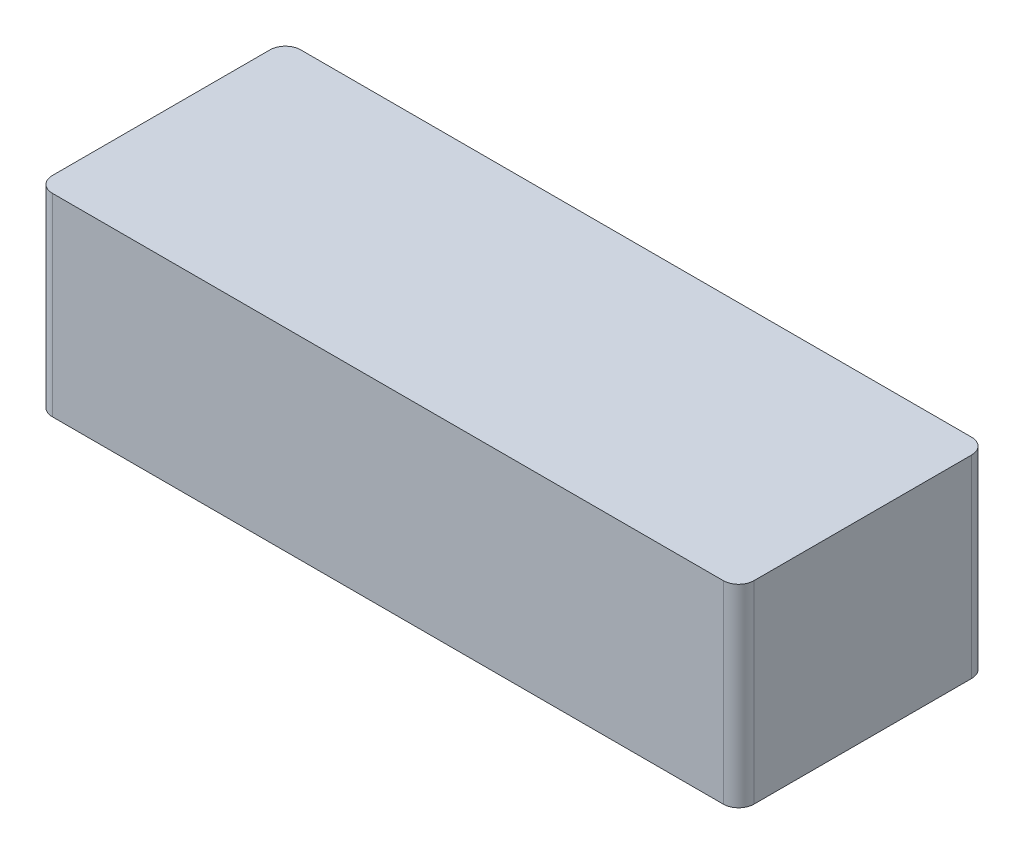
from build123d import *

# Parameters (mm, degrees)
BOSS_EXTRUDE1_DEPTH = 31.5
SHELL1_T            = -1
BOSS_EXTRUDE2_DEPTH = 30.5
BOSS_EXTRUDE4_START = -6.3
BOSS_EXTRUDE4_DEPTH = 6.3
SKETCH5_R           = 1.5
CUT_EXTRUDE2_DEPTH  = 5


with BuildPart() as part:
    # Sketch1 → Boss-Extrude1 (new body)
    with BuildSketch(Plane(origin=(0, 0, 0), x_dir=(1, 0, 0), z_dir=(0, 1, 0))):
        with BuildLine():
            Line((-68.5, -21.25), (-68.5, 21.25))
            ThreePointArc((-68.5, 21.25), (-67.621320344, 23.371320344), (-65.5, 24.25))
            Line((-65.5, 24.25), (65.5, 24.25))
            ThreePointArc((65.5, 24.25), (67.621320344, 23.371320344), (68.5, 21.25))
            Line((68.5, 21.25), (68.5, -21.25))
            ThreePointArc((68.5, -21.25), (67.621320344, -23.371320344), (65.5, -24.25))
            Line((65.5, -24.25), (-65.5, -24.25))
            ThreePointArc((-65.5, -24.25), (-67.621320344, -23.371320344), (-68.5, -21.25))
        make_face()
    extrude(amount=BOSS_EXTRUDE1_DEPTH)

    # Shell1
    shell1_openings = [part.faces().sort_by_distance(p)[0] for p in [
        (0, 0, 0),
    ]]
    offset(amount=SHELL1_T, openings=shell1_openings, kind=Kind.INTERSECTION)

    # Sketch2 → Boss-Extrude2 (add)
    with BuildSketch(Plane(origin=(0, 0, 0), x_dir=(1, 0, 0), z_dir=(0, 1, 0))):
        with BuildLine():
            Line((-68.5, 21.25), (-68.5, 17))
            Line((-68.5, 17), (-63.5, 17))
            ThreePointArc((-63.5, 17), (-61.909009742, 17.659009742), (-61.25, 19.25))
            Line((-61.25, 19.25), (-61.25, 24.25))
            Line((-61.25, 24.25), (-65.5, 24.25))
            ThreePointArc((-65.5, 24.25), (-67.621320344, 23.371320344), (-68.5, 21.25))
        make_face()
        with BuildLine():
            Line((-65.5, -24.25), (-61.25, -24.25))
            Line((-61.25, -24.25), (-61.25, -19.25))
            ThreePointArc((-61.25, -19.25), (-61.909009742, -17.659009742), (-63.5, -17))
            Line((-63.5, -17), (-68.5, -17))
            Line((-68.5, -17), (-68.5, -21.25))
            ThreePointArc((-68.5, -21.25), (-67.621320344, -23.371320344), (-65.5, -24.25))
        make_face()
        with BuildLine():
            Line((68.5, 21.25), (68.5, 17))
            Line((68.5, 17), (63.5, 17))
            ThreePointArc((63.5, 17), (61.909009742, 17.659009742), (61.25, 19.25))
            Line((61.25, 19.25), (61.25, 24.25))
            Line((61.25, 24.25), (65.5, 24.25))
            ThreePointArc((65.5, 24.25), (67.621320344, 23.371320344), (68.5, 21.25))
        make_face()
        with BuildLine():
            Line((61.25, -19.25), (61.25, -24.25))
            Line((61.25, -24.25), (65.5, -24.25))
            ThreePointArc((65.5, -24.25), (67.621320344, -23.371320344), (68.5, -21.25))
            Line((68.5, -21.25), (68.5, -17))
            Line((68.5, -17), (63.5, -17))
            ThreePointArc((63.5, -17), (61.909009742, -17.659009742), (61.25, -19.25))
        make_face()
    extrude(amount=BOSS_EXTRUDE2_DEPTH)

    # Sketch4 → Boss-Extrude4 (add)
    with BuildSketch(Plane(origin=(0, 0, 0), x_dir=(1, 0, 0), z_dir=(0, 1, 0)).offset(BOSS_EXTRUDE4_START)):
        with BuildLine():
            Line((-68.5, -21.25), (-68.5, 21.25))
            ThreePointArc((-68.5, 21.25), (-67.621320344, 23.371320344), (-65.5, 24.25))
            Line((-65.5, 24.25), (65.5, 24.25))
            ThreePointArc((65.5, 24.25), (67.621320344, 23.371320344), (68.5, 21.25))
            Line((68.5, 21.25), (68.5, -21.25))
            ThreePointArc((68.5, -21.25), (67.621320344, -23.371320344), (65.5, -24.25))
            Line((65.5, -24.25), (-65.5, -24.25))
            ThreePointArc((-65.5, -24.25), (-67.621320344, -23.371320344), (-68.5, -21.25))
        make_face()
        with BuildLine():
            Line((-65.5, -23.25), (65.5, -23.25))
            ThreePointArc((65.5, -23.25), (66.914213562, -22.664213562), (67.5, -21.25))
            Line((67.5, -21.25), (67.5, 21.25))
            ThreePointArc((67.5, 21.25), (66.914213562, 22.664213562), (65.5, 23.25))
            Line((65.5, 23.25), (-65.5, 23.25))
            ThreePointArc((-65.5, 23.25), (-66.914213562, 22.664213562), (-67.5, 21.25))
            Line((-67.5, 21.25), (-67.5, -21.25))
            ThreePointArc((-67.5, -21.25), (-66.914213562, -22.664213562), (-65.5, -23.25))
        make_face(mode=Mode.SUBTRACT)
    extrude(amount=BOSS_EXTRUDE4_DEPTH)

    # Sketch5 → Cut-Extrude2 (cut)
    with BuildSketch(Plane.XZ):
        with Locations(Location((-63.5, 19.25, 0), (0, 0, 270))):
            Circle(SKETCH5_R)
        with Locations(Location((-63.5, -19.25, 0), (0, 0, 270))):
            Circle(SKETCH5_R)
        with Locations(Location((63.5, 19.25, 0), (0, 0, 270))):
            Circle(SKETCH5_R)
        with Locations(Location((63.5, -19.25, 0), (0, 0, 270))):
            Circle(SKETCH5_R)
    extrude(amount=-CUT_EXTRUDE2_DEPTH, mode=Mode.SUBTRACT)


solid = part.part
